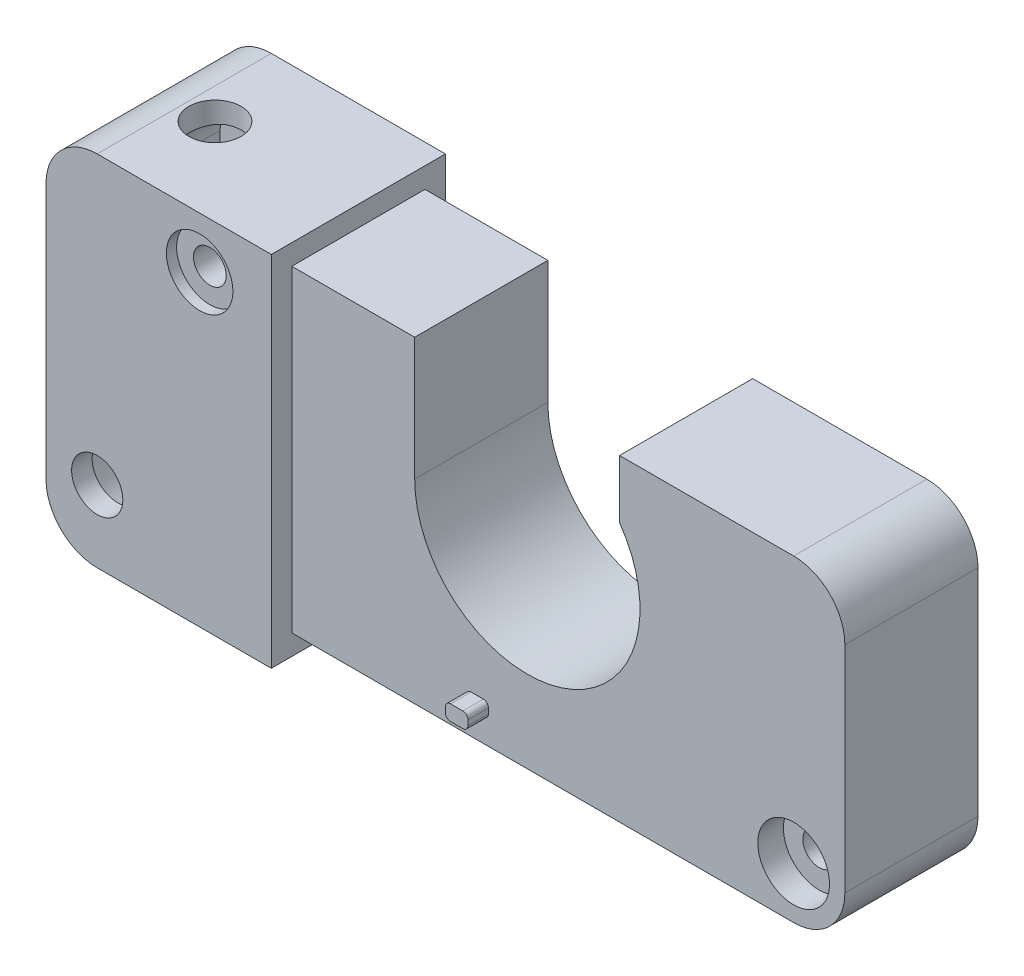
from build123d import *

# Parameters (mm, degrees)
BOSS_EXTRUDE1_DEPTH  = 17
CUT_EXTRUDE1_START   = -17
SKETCH3_W            = 12
SKETCH3_H            = 2
CUT_EXTRUDE1_DEPTH   = 17
CUT_EXTRUDE2_START   = -2
CUT_EXTRUDE2_DEPTH   = 2
SKETCH5_W            = 60
SKETCH5_H            = 35
CUT_EXTRUDE3_DEPTH   = 2
CUT_EXTRUDE4_DEPTH   = 11
CUT_EXTRUDE11_DEPTH  = 13
BOSS_EXTRUDE2_DEPTH  = 2
SKETCH13_R           = 2.5
CUT_EXTRUDE12_DEPTH  = 5
SKETCH14_R           = 2.55
CUT_EXTRUDE14_DEPTH  = 15
BOSS_EXTRUDE5_REACH  = 87.381
SKETCH15_R           = 3.25
SKETCH15_R_2         = 1.6
SKETCH15_4_R         = 3.25
SKETCH15_4_R_2       = 1.6
CUT_EXTRUDE16_DEPTH  = 1
SKETCH18_R           = 1.6
CUT_EXTRUDE17_DEPTH  = 15
SKETCH20_R           = 4.5
SKETCH20_R_2         = 1.6
BOSS_EXTRUDE6_DEPTH  = 13
SKETCH20_3_R         = 1.6
CUT_EXTRUDE20_DEPTH  = 86.005882191
SKETCH22_W           = 13
SKETCH22_H           = 31
SKETCH22_W_2         = 11
SKETCH22_H_2         = 29
BOSS_EXTRUDE7_DEPTH  = 3
SKETCH21_R           = 3.5
CUT_EXTRUDE21_DEPTH  = 2
SKETCH29_R           = 3.5
CUT_EXTRUDE22_DEPTH  = 2.5
BOSS_EXTRUDE10_DEPTH = 13


with BuildPart() as part:
    # Sketch1 → Boss-Extrude1 (new body)
    with BuildSketch(Plane.XY):
        with BuildLine():
            ThreePointArc((0, 5), (1.464466094, 1.464466094), (5, 0))
            Line((5, 0), (73, 0))
            ThreePointArc((73, 0), (76.535533906, 1.464466094), (78, 5))
            Line((78, 5), (78, 30))
            ThreePointArc((78, 30), (76.535533906, 33.535533906), (73, 35))
            Line((73, 35), (54, 35))
            Line((54, 35), (54, 27.32455532))
            ThreePointArc((54, 27.32455532), (48.31662479, 10.511911518), (34, 21))
            Line((34, 21), (34, 35))
            Line((34, 35), (5, 35))
            ThreePointArc((5, 35), (1.464466094, 33.535533906), (0, 30))
            Line((0, 30), (0, 5))
        make_face()
    extrude(amount=BOSS_EXTRUDE1_DEPTH)

    # Sketch3 → Cut-Extrude1 (cut)
    with BuildSketch(Plane.XY.offset(17).offset(CUT_EXTRUDE1_START)):
        with Locations((28, 34)):
            Rectangle(SKETCH3_W, SKETCH3_H)
        with BuildLine():
            Line((54, 33), (71, 33))
            ThreePointArc((71, 33), (74.535533906, 31.535533906), (76, 28))
            Line((76, 28), (76, 7))
            ThreePointArc((76, 7), (74.535533906, 3.464466094), (71, 2))
            Line((71, 2), (22, 2))
            Line((22, 2), (22, 0))
            Line((22, 0), (73, 0))
            ThreePointArc((73, 0), (76.535533906, 1.464466094), (78, 5))
            Line((78, 5), (78, 30))
            ThreePointArc((78, 30), (76.535533906, 33.535533906), (73, 35))
            Line((73, 35), (54, 35))
            Line((54, 35), (54, 33))
        make_face()
    extrude(amount=CUT_EXTRUDE1_DEPTH, mode=Mode.SUBTRACT)

    # Sketch3<3> → Cut-Extrude2 (cut)
    with BuildSketch(Plane.XY.offset(17).offset(CUT_EXTRUDE2_START)):
        with BuildLine():
            ThreePointArc((76, 28), (74.535533906, 31.535533906), (71, 33))
            Line((71, 33), (54, 33))
            Line((54, 33), (54, 27.32455532))
            ThreePointArc((54, 27.32455532), (48.31662479, 10.511911518), (34, 21))
            Line((34, 21), (34, 33))
            Line((34, 33), (22, 33))
            Line((22, 33), (22, 2))
            Line((22, 2), (71, 2))
            ThreePointArc((71, 2), (74.535533906, 3.464466094), (76, 7))
            Line((76, 7), (76, 28))
        make_face()
    extrude(amount=CUT_EXTRUDE2_DEPTH, mode=Mode.SUBTRACT)

    # Sketch5 → Cut-Extrude3 (cut)
    with BuildSketch(Plane(origin=(0, 0, 0), x_dir=(-1, 0, 0), z_dir=(0, 0, -1))):
        with Locations((-52, 15.5)):
            Rectangle(SKETCH5_W, SKETCH5_H)
    extrude(amount=-CUT_EXTRUDE3_DEPTH, mode=Mode.SUBTRACT)

    # Sketch6 → Cut-Extrude4 (cut)
    with BuildSketch(Plane.XY.offset(14)):
        with BuildLine():
            Line((22, 32), (69.5, 32))
            ThreePointArc((69.5, 32), (73.035533906, 30.535533906), (74.5, 27))
            Line((74.5, 27), (74.5, 8))
            ThreePointArc((74.5, 8), (73.035533906, 4.464466094), (69.5, 3))
            Line((69.5, 3), (22, 3))
            Line((22, 3), (22, 32))
        make_face()
    extrude(amount=-CUT_EXTRUDE4_DEPTH, mode=Mode.SUBTRACT)

    # Sketch11 → Cut-Extrude11 (cut)
    with BuildSketch(Plane.XY.offset(15)):
        with BuildLine():
            Line((22, 2), (7, 2))
            ThreePointArc((7, 2), (3.464466094, 3.464466094), (2, 7))
            Line((2, 7), (2, 28))
            ThreePointArc((2, 28), (3.464466094, 31.535533906), (7, 33))
            Line((7, 33), (22, 33))
            Line((22, 33), (22, 2))
        make_face()
    extrude(amount=-CUT_EXTRUDE11_DEPTH, mode=Mode.SUBTRACT)


with BuildPart() as cut_extrude11_piece_1:
    # of the separate pieces the step leaves, piece 1, a body of its own (cut_extrude11_pieces)
    add(part.part.solids().sort_by_distance((0, 30, 0))[0])

    # Sketch13 → Cut-Extrude12 (cut)
    with BuildSketch(Plane.XY.offset(17)):
        with Locations((5, 7)):
            Circle(SKETCH13_R)
    extrude(amount=-CUT_EXTRUDE12_DEPTH, mode=Mode.SUBTRACT)

    # Sketch14 → Cut-Extrude14 (cut)
    with BuildSketch(Plane(origin=(0, 35, 0), x_dir=(1, 0, 0), z_dir=(0, 1, 0))):
        with Locations(Location((8, -8.5, 0), (0, 0, 270))):
            Circle(SKETCH14_R)
    extrude(amount=-CUT_EXTRUDE14_DEPTH, mode=Mode.SUBTRACT)

    # Sketch15 → Boss-Extrude5 (add, up to next)
    with BuildSketch(Plane.XY.offset(17), mode=Mode.PRIVATE) as boss_extrude5_sk1:
        with Locations((15, 30)):
            Circle(SKETCH15_R)
        with Locations((15, 30)):
            Circle(SKETCH15_R_2, mode=Mode.SUBTRACT)
    boss_extrude5_tool1 = extrude(boss_extrude5_sk1.sketch, amount=-BOSS_EXTRUDE5_REACH, mode=Mode.PRIVATE) - cut_extrude11_piece_1.part
    add(boss_extrude5_tool1.solids().sort_by_distance((11.841924, 30, 17))[0])

    # Sketch15<4> → Cut-Extrude16 (cut)
    with BuildSketch(Plane.XY.offset(17)):
        with Locations((15, 30)):
            Circle(SKETCH15_4_R)
        with Locations((15, 30)):
            Circle(SKETCH15_4_R_2, mode=Mode.SUBTRACT)
    extrude(amount=-CUT_EXTRUDE16_DEPTH, mode=Mode.SUBTRACT)

    # Sketch18 → Cut-Extrude17 (cut)
    with BuildSketch(Plane.XY.offset(17)):
        with Locations((15, 30)):
            Circle(SKETCH18_R)
    extrude(amount=-CUT_EXTRUDE17_DEPTH, mode=Mode.SUBTRACT)

    # Sketch22 → Boss-Extrude7 (add)
    with BuildSketch(Plane(origin=(22, 0, 0), x_dir=(0, 0, -1), z_dir=(1, 0, 0))):
        with Locations((-8.5, 17.5)):
            Rectangle(SKETCH22_W, SKETCH22_H)
        with Locations((-8.5, 17.5)):
            Rectangle(SKETCH22_W_2, SKETCH22_H_2, mode=Mode.SUBTRACT)
    extrude(amount=-BOSS_EXTRUDE7_DEPTH)


with BuildPart() as cut_extrude11_piece_2:
    # of the separate pieces the step leaves, piece 2, a body of its own (cut_extrude11_pieces)
    add(part.part.solids().sort_by_distance((34, 33, 2))[0])

    # Sketch12 → Boss-Extrude2 (add)
    with BuildSketch(Plane.XY.offset(15)):
        with BuildLine():
            Line((39.5, 5.75), (40.7, 5.75))
            ThreePointArc((40.7, 5.75), (41.053553391, 5.603553391), (41.2, 5.25))
            Line((41.2, 5.25), (41.2, 4.75))
            ThreePointArc((41.2, 4.75), (41.053553391, 4.396446609), (40.7, 4.25))
            Line((40.7, 4.25), (39.5, 4.25))
            ThreePointArc((39.5, 4.25), (39.146446609, 4.396446609), (39, 4.75))
            Line((39, 4.75), (39, 5.25))
            ThreePointArc((39, 5.25), (39.146446609, 5.603553391), (39.5, 5.75))
        make_face()
    extrude(amount=BOSS_EXTRUDE2_DEPTH)

    # Sketch20 → Boss-Extrude6 (add)
    with BuildSketch(Plane.XY.offset(15)):
        with Locations((71, 7)):
            Circle(SKETCH20_R)
        with Locations((71, 7)):
            Circle(SKETCH20_R_2, mode=Mode.SUBTRACT)
    extrude(amount=-BOSS_EXTRUDE6_DEPTH)

    # Sketch20<3> → Cut-Extrude20 (cut, through all)
    with BuildSketch(Plane.XY.offset(15)):
        with Locations((71, 7)):
            Circle(SKETCH20_3_R)
    extrude(amount=-CUT_EXTRUDE20_DEPTH, mode=Mode.SUBTRACT)

    # Sketch21 → Cut-Extrude21 (cut)
    with BuildSketch(Plane(origin=(0, 0, 2), x_dir=(-1, 0, 0), z_dir=(0, 0, -1))):
        with Locations((-71, 7)):
            Circle(SKETCH21_R)
    extrude(amount=-CUT_EXTRUDE21_DEPTH, mode=Mode.SUBTRACT)

    # Sketch29 → Cut-Extrude22 (cut)
    with BuildSketch(Plane.XY.offset(15)):
        with Locations(Location((71, 7, 0), (0, 0, 180))):
            Circle(SKETCH29_R)
    extrude(amount=-CUT_EXTRUDE22_DEPTH, mode=Mode.SUBTRACT)

    # Sketch36 → Boss-Extrude10 (add)
    with BuildSketch(Plane.XY.offset(15)):
        with BuildLine():
            Line((34, 21), (34, 33))
            Line((34, 33), (33.3, 33))
            Line((33.3, 33), (33.3, 21))
            ThreePointArc((33.3, 21), (48.314061384, 9.565059525), (54.7, 27.32455532))
            Line((54.7, 27.32455532), (54.7, 33))
            Line((54.7, 33), (54, 33))
            Line((54, 33), (54, 27.32455532))
            ThreePointArc((54, 27.32455532), (48.31662479, 10.511911518), (34, 21))
        make_face()
    extrude(amount=-BOSS_EXTRUDE10_DEPTH)


solid = Compound([cut_extrude11_piece_1.part, cut_extrude11_piece_2.part])
